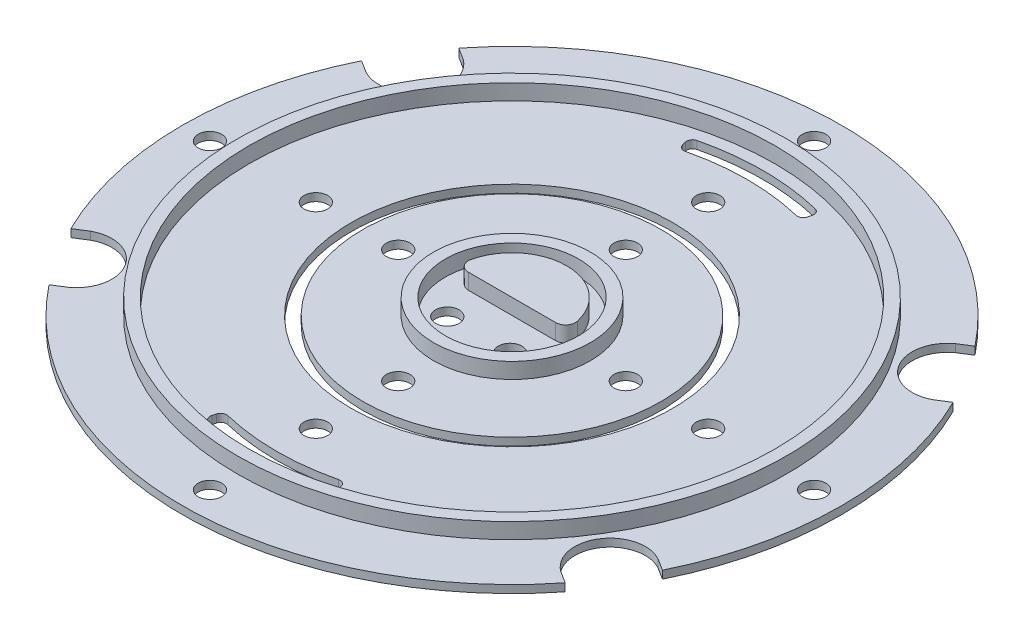
from build123d import *

# Parameters (mm, degrees)
SKETCH_1_R          = 35
EXTRUDE_1_DEPTH     = 2
SKETCH_2_R          = 33.5
SKETCH_2_R_2        = 10
SKETCH_2_R_3        = 8.490267481
CUT_EXTRUDE_1_DEPTH = 2
SKETCH_5_R          = 42
EXTRUDE_3_DEPTH     = 2
CUT_EXTRUDE_3_DEPTH = 2
SKETCH_7_R          = 1.5
CUT_EXTRUDE_4_DEPTH = 2
CUT_EXTRUDE_5_DEPTH = 2
SKETCH_10_R         = 20.5
SKETCH_10_R_2       = 19
CUT_EXTRUDE_6_DEPTH = 2
SKETCH_11_R         = 1.5
CUT_EXTRUDE_7_DEPTH = 2
SKETCH_12_R         = 1.5
CUT_EXTRUDE_8_DEPTH = 2
SKETCH_13_R         = 42
CUT_EXTRUDE_9_DEPTH = 1
SKETCH_15_R         = 2
EXTRUDE_5_DEPTH     = 4


with BuildPart() as part:
    # Эскиз1 → Бобышка-Вытянуть1 (new body)
    with BuildSketch(Plane(origin=(0, 0, 0), x_dir=(1, 0, 0), z_dir=(0, 1, 0))):
        with Locations(Location((0, 0, 0), (0, 0, 270))):
            Circle(SKETCH_1_R)
    extrude(amount=EXTRUDE_1_DEPTH)

    # Эскиз2 → Вырез-Вытянуть1 (cut)
    # profile 1 of 2: a face of its own
    with BuildSketch(Plane(origin=(0, 2, 0), x_dir=(1, 0, 0), z_dir=(0, 1, 0))):
        with Locations(Location((0, 0, 0), (0, 0, 270))):
            Circle(SKETCH_2_R)
        with Locations(Location((0, 0, 0), (0, 0, 270))):
            Circle(SKETCH_2_R_2, mode=Mode.SUBTRACT)
    # profile 2 of 2: a face of its own
    with BuildSketch(Plane(origin=(0, 2, 0), x_dir=(1, 0, 0), z_dir=(0, 1, 0))):
        with Locations(Location((0, 0, 0), (0, 0, 270))):
            Circle(SKETCH_2_R_3)
        with BuildLine():
            Line((5.565646409, 0), (-5.565646409, 0))
            ThreePointArc((-5.565646409, 0), (-6.552289655, 0.474742908), (-6.796984316, 1.5419684))
            ThreePointArc((-6.796984316, 1.5419684), (0, 6.969696), (6.796984316, 1.5419684))
            ThreePointArc((6.796984316, 1.5419684), (6.552289655, 0.474742908), (5.565646409, 0))
        make_face(mode=Mode.SUBTRACT)
    extrude(amount=-CUT_EXTRUDE_1_DEPTH, mode=Mode.SUBTRACT)


with BuildPart() as cut_extrude_1_piece_1:
    # of the separate pieces the step leaves, piece 1, a body of its own (cut_extrude_1_pieces)
    add(part.part.solids().sort_by_distance((0, 0, 35))[0])


with BuildPart() as cut_extrude_1_piece_2:
    # of the separate pieces the step leaves, piece 2, a body of its own (cut_extrude_1_pieces)
    add(part.part.solids().sort_by_distance((0, 0, 10))[0])


with BuildPart() as cut_extrude_1_piece_3:
    # of the separate pieces the step leaves, piece 3, a body of its own (cut_extrude_1_pieces)
    add(part.part.solids().sort_by_distance((6.796984316, 0, -1.5419684))[0])

    # Эскиз5 → Бобышка-Вытянуть3 (add)
    with BuildSketch(Plane.XZ):
        with Locations(Location((0, 0, 0), (0, 0, 270))):
            Circle(SKETCH_5_R)
    extrude(amount=EXTRUDE_3_DEPTH)

    # Эскиз6 → Вырез-Вытянуть3 (cut)
    with BuildSketch(Plane.XZ.offset(2)):
        with BuildLine():
            Line((37.693744248, 18.519588007), (37.695835599, 18.520906524))
            ThreePointArc((37.695835599, 18.520906524), (35.49929728, 22.445487133), (32.895702092, 26.112693923))
            Line((32.895702092, 26.112693923), (31.362829157, 25.146276175))
            ThreePointArc((31.362829157, 25.146276175), (30.194326868, 19.098572921), (36.15607968, 17.550149318))
            Line((36.15607968, 17.550149318), (37.693744248, 18.519588007))
        make_face()
        with BuildLine():
            Line((-31.362829157, 25.146276175), (-32.895702092, 26.112693923))
            ThreePointArc((-32.895702092, 26.112693923), (-35.49929728, 22.445487133), (-37.695835599, 18.520906524))
            Line((-37.695835599, 18.520906524), (-37.693744248, 18.519588007))
            Line((-37.693744248, 18.519588007), (-36.15607968, 17.550149318))
            ThreePointArc((-36.15607968, 17.550149318), (-30.194326868, 19.098572921), (-31.362829157, 25.146276175))
        make_face()
        with BuildLine():
            Line((-37.693744248, -18.519588007), (-37.695835599, -18.520906524))
            ThreePointArc((-37.695835599, -18.520906524), (-35.49929728, -22.445487133), (-32.895702092, -26.112693923))
            Line((-32.895702092, -26.112693923), (-31.362829157, -25.146276175))
            ThreePointArc((-31.362829157, -25.146276175), (-30.194326868, -19.098572921), (-36.15607968, -17.550149318))
            Line((-36.15607968, -17.550149318), (-37.693744248, -18.519588007))
        make_face()
        with BuildLine():
            Line((31.362829157, -25.146276175), (32.895702092, -26.112693923))
            ThreePointArc((32.895702092, -26.112693923), (35.49929728, -22.445487133), (37.695835599, -18.520906524))
            Line((37.695835599, -18.520906524), (37.693744248, -18.519588007))
            Line((37.693744248, -18.519588007), (36.15607968, -17.550149318))
            ThreePointArc((36.15607968, -17.550149318), (30.194326868, -19.098572921), (31.362829157, -25.146276175))
        make_face()
    extrude(amount=-CUT_EXTRUDE_3_DEPTH, mode=Mode.SUBTRACT)

    # Эскиз7 → Вырез-Вытянуть4 (cut)
    with BuildSketch(Plane(origin=(0, 0, 0), x_dir=(1, 0, 0), z_dir=(0, 1, 0))):
        with Locations(Location((0, 25, 0), (0, 0, 270))):
            Circle(SKETCH_7_R)
        with Locations(Location((-25, 0, 0), (0, 0, 270))):
            Circle(SKETCH_7_R)
        with Locations(Location((25, 0, 0), (0, 0, 270))):
            Circle(SKETCH_7_R)
        with Locations(Location((0, -25, 0), (0, 0, 270))):
            Circle(SKETCH_7_R)
        with Locations(Location((4, -4.24513374, 0), (0, 0, 270))):
            Circle(SKETCH_7_R)
        with Locations(Location((-4, -4.24513374, 0), (0, 0, 270))):
            Circle(SKETCH_7_R)
    extrude(amount=-CUT_EXTRUDE_4_DEPTH, mode=Mode.SUBTRACT)

    # Эскиз9 → Вырез-Вытянуть5 (cut)
    with BuildSketch(Plane(origin=(0, 0, 0), x_dir=(1, 0, 0), z_dir=(0, 1, 0))):
        with BuildLine():
            Line((-7.956318037, -29.693383157), (-8.085765453, -30.176487487))
            ThreePointArc((-8.085765453, -30.176487487), (-8.006293038, -30.753369556), (-7.537992789, -31.099496213))
            ThreePointArc((-7.537992789, -31.099496213), (0, -32), (7.537992789, -31.099496213))
            ThreePointArc((7.537992789, -31.099496213), (8.006293038, -30.753369556), (8.085765453, -30.176487487))
            Line((8.085765453, -30.176487487), (7.956318037, -29.693383157))
            ThreePointArc((7.956318037, -29.693383157), (7.614767331, -29.242600206), (7.055486505, -29.158534088))
            ThreePointArc((7.055486505, -29.158534088), (0, -30), (-7.055486505, -29.158534088))
            ThreePointArc((-7.055486505, -29.158534088), (-7.614767331, -29.242600206), (-7.956318037, -29.693383157))
        make_face()
        with BuildLine():
            Line((7.956318037, 29.693383157), (8.085765453, 30.176487487))
            ThreePointArc((8.085765453, 30.176487487), (8.006293038, 30.753369556), (7.537992789, 31.099496213))
            ThreePointArc((7.537992789, 31.099496213), (0, 32), (-7.537992789, 31.099496213))
            ThreePointArc((-7.537992789, 31.099496213), (-8.006293038, 30.753369556), (-8.085765453, 30.176487487))
            Line((-8.085765453, 30.176487487), (-7.956318037, 29.693383157))
            ThreePointArc((-7.956318037, 29.693383157), (-7.614767331, 29.242600206), (-7.055486505, 29.158534088))
            ThreePointArc((-7.055486505, 29.158534088), (0, 30), (7.055486505, 29.158534088))
            ThreePointArc((7.055486505, 29.158534088), (7.614767331, 29.242600206), (7.956318037, 29.693383157))
        make_face()
    extrude(amount=-CUT_EXTRUDE_5_DEPTH, mode=Mode.SUBTRACT)

    # Эскиз10 → Вырез-Вытянуть6 (cut)
    with BuildSketch(Plane(origin=(0, 0, 0), x_dir=(1, 0, 0), z_dir=(0, 1, 0))):
        with Locations(Location((0, 0, 0), (0, 0, 270))):
            Circle(SKETCH_10_R)
        with Locations(Location((0, 0, 0), (0, 0, 270))):
            Circle(SKETCH_10_R_2, mode=Mode.SUBTRACT)
    extrude(amount=-CUT_EXTRUDE_6_DEPTH, mode=Mode.SUBTRACT)


with BuildPart() as cut_extrude_6_piece_1:
    # of the separate pieces the step leaves, piece 1, a body of its own (cut_extrude_6_pieces)
    add(cut_extrude_1_piece_3.part.solids().sort_by_distance((-32.895702092, 0, -26.112693923))[0])

    # Эскиз12 → Вырез-Вытянуть8 (cut)
    with BuildSketch(Plane(origin=(0, 0, 0), x_dir=(1, 0, 0), z_dir=(0, 1, 0))):
        with Locations(Location((0, -38.5, 0), (0, 0, 270))):
            Circle(SKETCH_12_R)
        with Locations(Location((-38.5, 0, 0), (0, 0, 270))):
            Circle(SKETCH_12_R)
        with Locations(Location((0, 38.5, 0), (0, 0, 270))):
            Circle(SKETCH_12_R)
        with Locations(Location((38.5, 0, 0), (0, 0, 270))):
            Circle(SKETCH_12_R)
    extrude(amount=-CUT_EXTRUDE_8_DEPTH, mode=Mode.SUBTRACT)


with BuildPart() as cut_extrude_6_piece_2:
    # of the separate pieces the step leaves, piece 2, a body of its own (cut_extrude_6_pieces)
    add(cut_extrude_1_piece_3.part.solids().sort_by_distance((0, 0, 19))[0])

    # Эскиз11 → Вырез-Вытянуть7 (cut)
    with BuildSketch(Plane(origin=(0, 0, 0), x_dir=(1, 0, 0), z_dir=(0, 1, 0))):
        with Locations(Location((0, 14.5, 0), (0, 0, 270))):
            Circle(SKETCH_11_R)
        with Locations(Location((14.5, 0, 0), (0, 0, 270))):
            Circle(SKETCH_11_R)
        with Locations(Location((0, -14.5, 0), (0, 0, 270))):
            Circle(SKETCH_11_R)
        with Locations(Location((-14.5, 0, 0), (0, 0, 270))):
            Circle(SKETCH_11_R)
    extrude(amount=-CUT_EXTRUDE_7_DEPTH, mode=Mode.SUBTRACT)


with BuildPart() as cut_extrude_9_tool:
    # Эскиз13 → Вырез-Вытянуть9 (new body)
    with BuildSketch(Plane.XZ.offset(2)):
        Circle(SKETCH_13_R)
    extrude(amount=-CUT_EXTRUDE_9_DEPTH)


with BuildPart() as cut_extrude_6_piece_1_1:
    add(cut_extrude_6_piece_1.part)

    # Вырез-Вытянуть9: cut by cut_extrude_9_tool
    add(cut_extrude_9_tool.part, mode=Mode.SUBTRACT)

    # Эскиз15 → Бобышка-Вытянуть5 (add)
    with BuildSketch(Plane.XZ.offset(1)):
        with Locations(Location((21.999920011, 21.935618834, 0), (0, 0, 270))):
            Circle(SKETCH_15_R)
        with Locations(Location((21.999920011, -22.064217134, 0), (0, 0, 270))):
            Circle(SKETCH_15_R)
        with Locations(Location((-21.999915957, -22.064217134, 0), (0, 0, 270))):
            Circle(SKETCH_15_R)
        with Locations(Location((-21.999915957, 21.935779051, 0), (0, 0, 270))):
            Circle(SKETCH_15_R)
        with Locations(Location((-8.4963e-05, 4.185778691, 0), (0, 0, 270))):
            Circle(SKETCH_15_R)
    extrude(amount=EXTRUDE_5_DEPTH)


with BuildPart() as cut_extrude_6_piece_2_1:
    add(cut_extrude_6_piece_2.part)

    # Вырез-Вытянуть9: cut by cut_extrude_9_tool
    add(cut_extrude_9_tool.part, mode=Mode.SUBTRACT)


with BuildPart() as extrude_5_piece_1:
    # of the separate pieces the step leaves, piece 1, a body of its own (extrude_5_pieces)
    add(cut_extrude_6_piece_1_1.part.solids().sort_by_distance((-32.895702092, 0, -26.112693923))[0])


with BuildPart() as extrude_5_piece_2:
    # of the separate pieces the step leaves, piece 2, a body of its own (extrude_5_pieces)
    add(cut_extrude_6_piece_1_1.part.solids().sort_by_distance((-8.4963e-05, -1, 2.185778691))[0])


solid = Compound([cut_extrude_1_piece_1.part, cut_extrude_1_piece_2.part, cut_extrude_6_piece_2_1.part, extrude_5_piece_1.part, extrude_5_piece_2.part])
